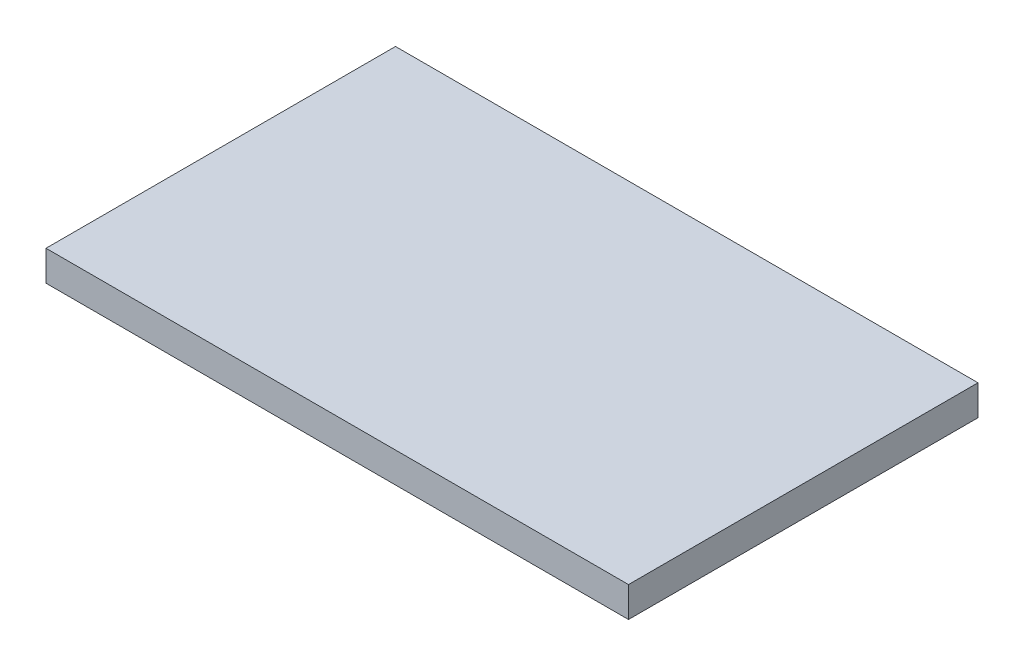
from build123d import *

# Parameters (mm, degrees)
SKETCH1_W           = 25
SKETCH1_H           = 15
BOSS_EXTRUDE1_DEPTH = 1.3


with BuildPart() as part:
    # Sketch1 → Boss-Extrude1 (new body)
    with BuildSketch(Plane(origin=(0, 0, 0), x_dir=(1, 0, 0), z_dir=(0, 1, 0))):
        Rectangle(SKETCH1_W, SKETCH1_H)
    extrude(amount=BOSS_EXTRUDE1_DEPTH)


solid = part.part
